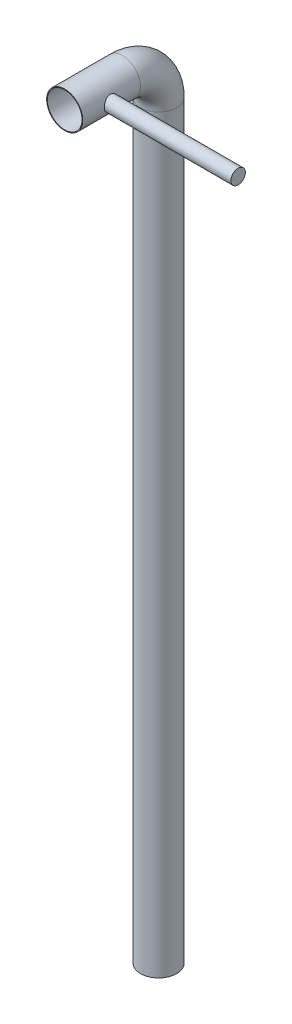
from build123d import *

# Parameters (mm, degrees)
IZIM2_R                          = 2.5
BO_ALTMA3_T                      = -0.1
Y_KSEKLIK_EKSTR_ZYON2_REACH      = 88.496
Y_KSEKLIK_EKSTR_ZYON2_END_RADIUS = 2.5
IZIM4_R                          = 1


with BuildPart() as part:
    # Süpür1: sweep along a path in Çizim1
    with BuildLine(Plane(origin=(0, 0, 0), x_dir=(0, 0, -1), z_dir=(1, 0, 0))) as s_p_r1_path:
        Line((0, -28.77), (0, 75))
        ThreePointArc((0, 75), (-1.464466094, 78.535533906), (-5, 80))
        Line((-5, 80), (-13, 80))
    # Çizim2 → Süpür1 (sweep)
    with BuildSketch(Plane.XY.offset(13)):
        with Locations((0, 80)):
            Circle(IZIM2_R)
    sweep(path=s_p_r1_path.line)

    # İç Boşaltma3
    bo_altma3_openings = [part.faces().sort_by_distance(p)[0] for p in [
        (0, 80, 13),
    ]]
    offset(amount=BO_ALTMA3_T, openings=bo_altma3_openings, kind=Kind.INTERSECTION)

    # Yükseklik-Ekstrüzyon2: up to this cylinder (the profile starts outside it)
    y_kseklik_ekstr_zyon2_end = Plane(origin=(0, 80, 9), z_dir=(0, 0, 1)) * Cylinder(Y_KSEKLIK_EKSTR_ZYON2_END_RADIUS, 182.992, mode=Mode.PRIVATE)
    # Çizim4 → Yükseklik-Ekstrüzyon2 (add, up to the surface)
    with BuildSketch(Plane(origin=(20, 0, 0), x_dir=(0, 0, -1), z_dir=(1, 0, 0)), mode=Mode.PRIVATE) as y_kseklik_ekstr_zyon2_sk1:
        with Locations((-9, 80)):
            Circle(IZIM4_R)
    y_kseklik_ekstr_zyon2_tool1 = extrude(y_kseklik_ekstr_zyon2_sk1.sketch, amount=-Y_KSEKLIK_EKSTR_ZYON2_REACH, mode=Mode.PRIVATE) - y_kseklik_ekstr_zyon2_end
    add(y_kseklik_ekstr_zyon2_tool1.solids().sort_by_distance((20, 80, 9))[0])


solid = part.part
